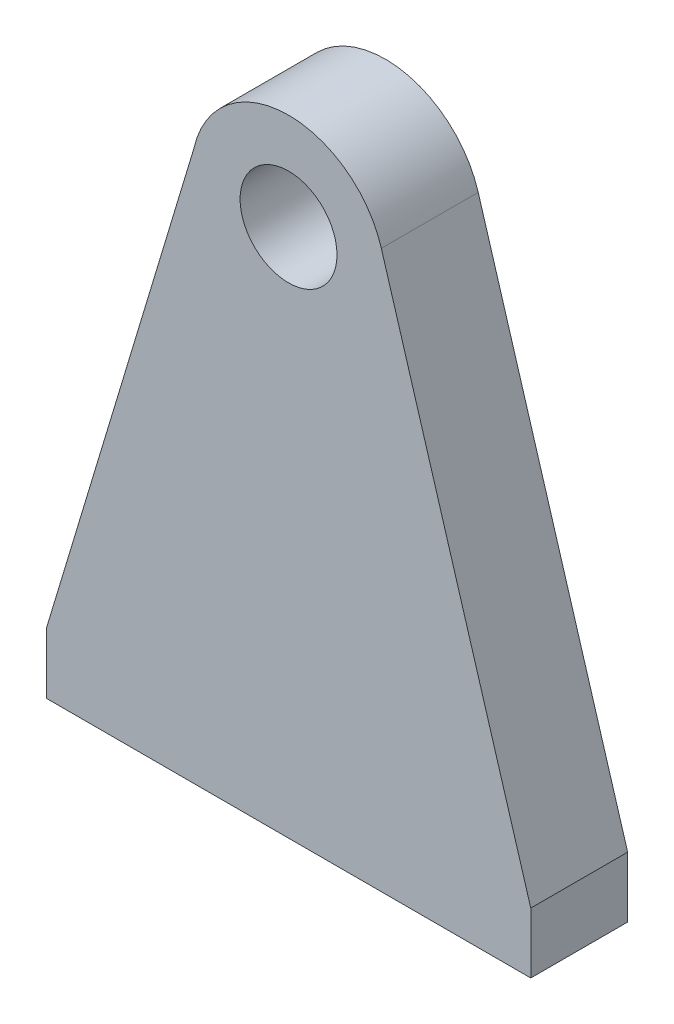
from build123d import *

# Parameters (mm, degrees)
SKETCH1_R           = 20
BOSS_EXTRUDE1_DEPTH = 40


with BuildPart() as part:
    # Sketch1 → Boss-Extrude1 (new body)
    with BuildSketch(Plane.XY):
        with BuildLine():
            Line((21.725099169, 227.637882638), (83.421301601, 22.583048084))
            Line((83.421301601, 22.583048084), (83.421301601, -2.416951916))
            Line((83.421301601, -2.416951916), (-116.578698399, -2.416951916))
            Line((-116.578698399, -2.416951916), (-116.578698399, 22.583048084))
            Line((-116.578698399, 22.583048084), (-55.649010242, 224.687006078))
            ThreePointArc((-55.649010242, 224.687006078), (-18.103101282, 256.084107965), (21.725099169, 227.637882638))
        make_face()
        with Locations((-16.578698399, 216.113166072)):
            Circle(SKETCH1_R, mode=Mode.SUBTRACT)
    extrude(amount=BOSS_EXTRUDE1_DEPTH)


solid = part.part
